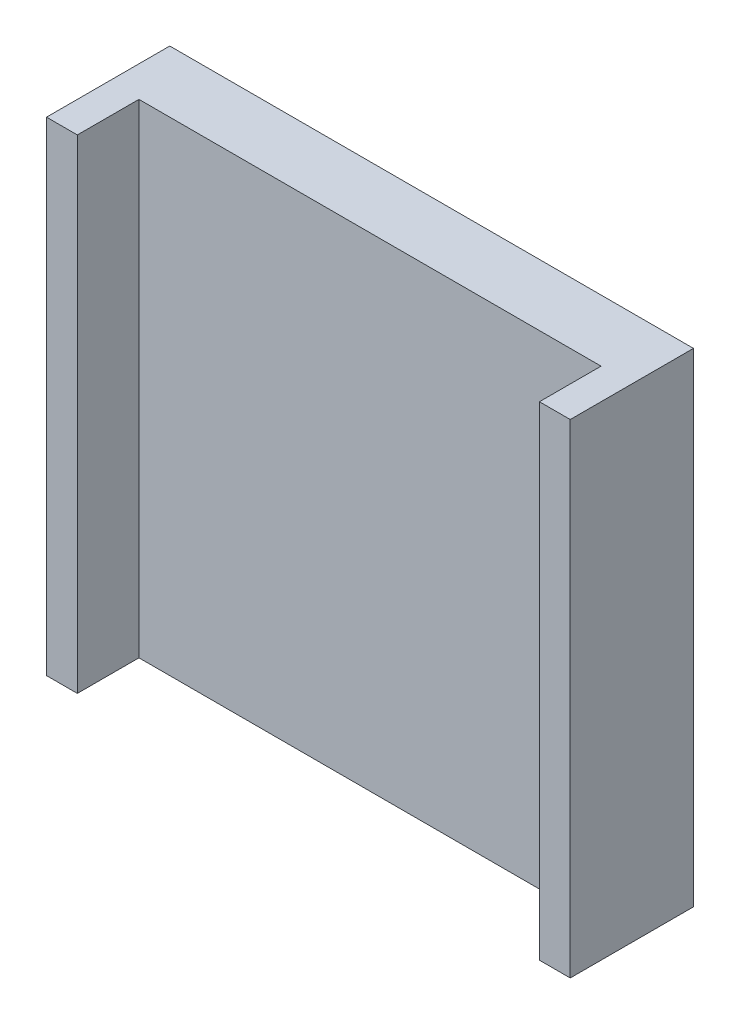
from build123d import *

# Parameters (mm, degrees)
SKETCH1_W           = 85
SKETCH1_H           = 20
BOSS_EXTRUDE1_DEPTH = 78.5
SKETCH2_W           = 75
SKETCH2_H           = 10
CUT_EXTRUDE1_DEPTH  = 88.5


with BuildPart() as part:
    # Sketch1 → Boss-Extrude1 (new body)
    with BuildSketch(Plane(origin=(0, 0, 0), x_dir=(1, 0, 0), z_dir=(0, 1, 0))):
        with Locations((12.219844181, 12.275922657)):
            Rectangle(SKETCH1_W, SKETCH1_H)
    extrude(amount=BOSS_EXTRUDE1_DEPTH)

    # Sketch2 → Cut-Extrude1 (cut)
    with BuildSketch(Plane(origin=(0, 78.5, 0), x_dir=(1, 0, 0), z_dir=(0, 1, 0))):
        with Locations((12.219844181, 7.275922657)):
            Rectangle(SKETCH2_W, SKETCH2_H)
    extrude(amount=-CUT_EXTRUDE1_DEPTH, mode=Mode.SUBTRACT)


solid = part.part
